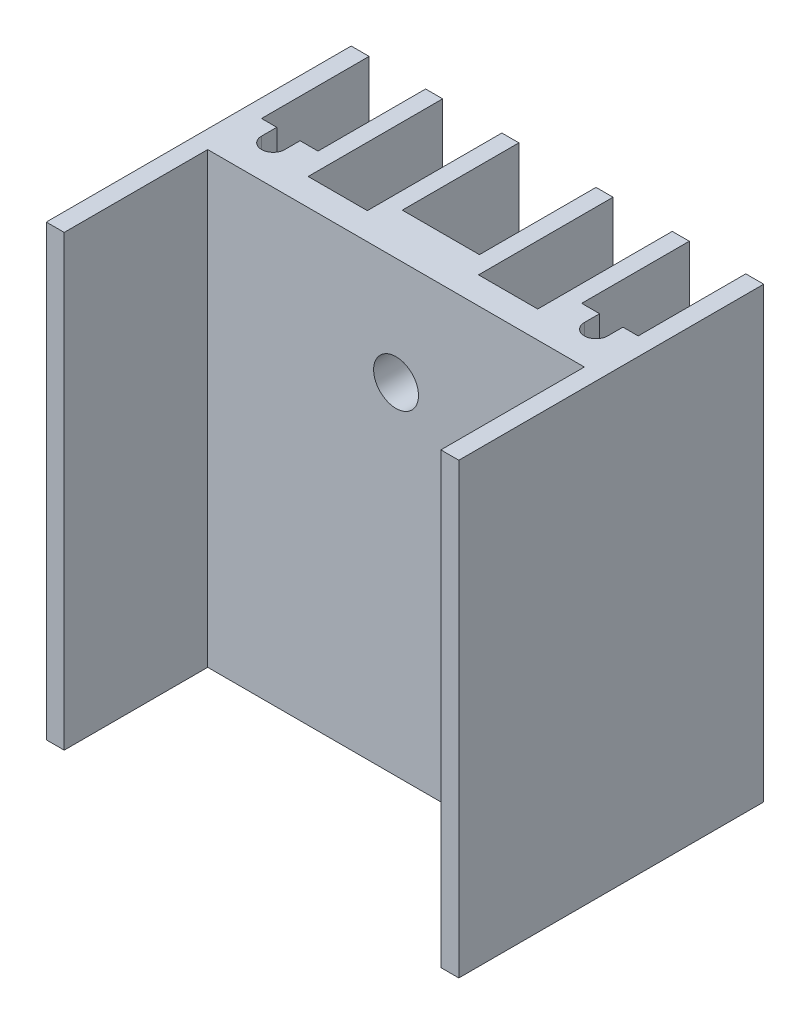
from build123d import *

# Parameters (mm, degrees)
SKETCH1_W           = 23
SKETCH1_H           = 17
BOSS_EXTRUDE1_DEPTH = 25
SKETCH2_W           = 21
SKETCH2_H           = 8
SKETCH2_W_2         = 3.15
SKETCH2_H_2         = 6
SKETCH2_W_3         = 3.3
SKETCH2_H_3         = 7.5
SKETCH2_W_4         = 4.3
SKETCH2_H_4         = 6.5
CUT_EXTRUDE1_DEPTH  = 29.801041648
CUT_EXTRUDE2_DEPTH  = 29.801041648
CUT_EXTRUDE3_REACH  = 30.953
SKETCH4_R           = 1.25


with BuildPart() as part:
    # Sketch1 → Boss-Extrude1 (new body)
    with BuildSketch(Plane(origin=(0, 0, 0), x_dir=(1, 0, 0), z_dir=(0, 1, 0))):
        Rectangle(SKETCH1_W, SKETCH1_H)
    extrude(amount=BOSS_EXTRUDE1_DEPTH)

    # Sketch2 → Cut-Extrude1 (cut, through all)
    with BuildSketch(Plane(origin=(0, 25, 0), x_dir=(1, 0, 0), z_dir=(0, 1, 0))):
        with Locations((0, -4.5)):
            Rectangle(SKETCH2_W, SKETCH2_H)
        with Locations((-8.925, 5.5)):
            Rectangle(SKETCH2_W_2, SKETCH2_H_2)
        with Locations((-4.75, 4.75)):
            Rectangle(SKETCH2_W_3, SKETCH2_H_3)
        with Locations((0, 5.25)):
            Rectangle(SKETCH2_W_4, SKETCH2_H_4)
        with Locations((4.75, 4.75)):
            Rectangle(SKETCH2_W_3, SKETCH2_H_3)
        with Locations((8.925, 5.5)):
            Rectangle(SKETCH2_W_2, SKETCH2_H_2)
    extrude(amount=-CUT_EXTRUDE1_DEPTH, mode=Mode.SUBTRACT)

    # Sketch3 → Cut-Extrude2 (cut, through all)
    with BuildSketch(Plane(origin=(0, 25, 0), x_dir=(1, 0, 0), z_dir=(0, 1, 0))):
        with BuildLine():
            Line((8.35, 2.5), (8.35, 1.65))
            ThreePointArc((8.35, 1.65), (9, 1), (9.65, 1.65))
            Line((9.65, 1.65), (9.65, 2.5))
            Line((9.65, 2.5), (8.35, 2.5))
        make_face()
        with BuildLine():
            Line((-8.35, 2.5), (-8.35, 1.65))
            ThreePointArc((-8.35, 1.65), (-9, 1), (-9.65, 1.65))
            Line((-9.65, 1.65), (-9.65, 2.5))
            Line((-9.65, 2.5), (-8.35, 2.5))
        make_face()
    extrude(amount=-CUT_EXTRUDE2_DEPTH, mode=Mode.SUBTRACT)

    # Sketch4 → Cut-Extrude3 (cut, up to next)
    with BuildSketch(Plane.XY.offset(0.5), mode=Mode.PRIVATE) as cut_extrude3_sk1:
        with Locations((0, 19)):
            Circle(SKETCH4_R)
    cut_extrude3_tool1 = extrude(cut_extrude3_sk1.sketch, amount=-CUT_EXTRUDE3_REACH, mode=Mode.PRIVATE) & part.part
    add(cut_extrude3_tool1.solids().sort_by_distance((0, 19, 0.5))[0], mode=Mode.SUBTRACT)


solid = part.part
